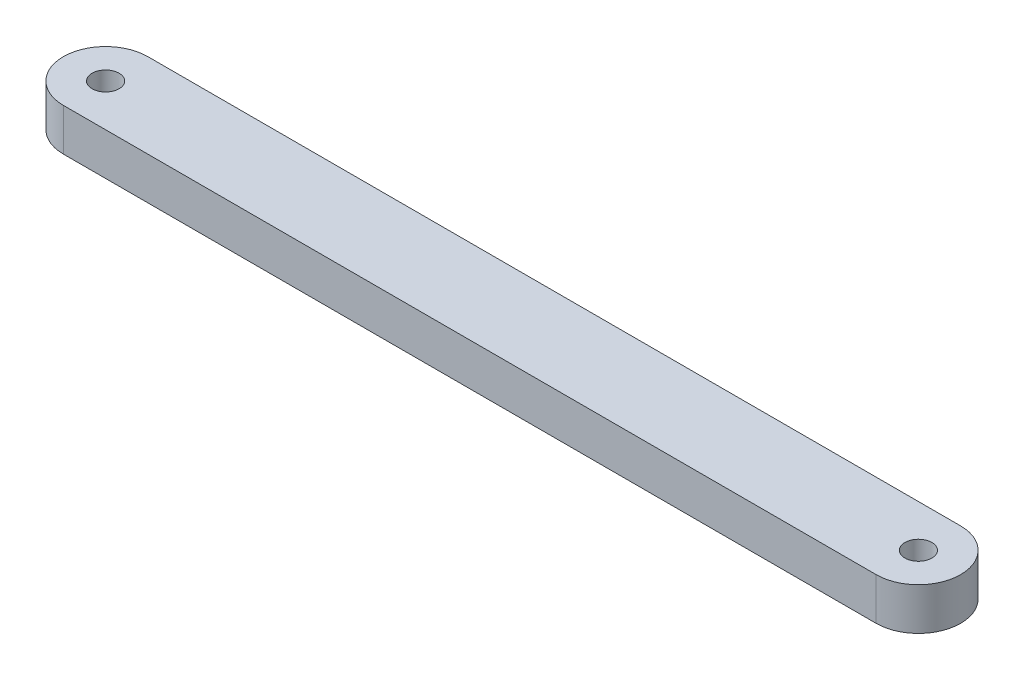
from build123d import *

# Parameters (mm, degrees)
SKETCH_1_R      = 1.6
EXTRUDE_1_DEPTH = 5


with BuildPart() as part:
    # ｽｹｯﾁ1 → ﾎﾞｽ - 押し出し1 (new body)
    with BuildSketch(Plane(origin=(0, 0, 0), x_dir=(1, 0, 0), z_dir=(0, 1, 0))):
        with BuildLine():
            Line((-48.13, 5), (48.13, 5))
            ThreePointArc((48.13, 5), (53.13, 0), (48.13, -5))
            Line((48.13, -5), (-48.13, -5))
            ThreePointArc((-48.13, -5), (-53.13, 0), (-48.13, 5))
        make_face()
        with Locations(Location((-48.13, 0, 0), (0, 0, 270))):
            Circle(SKETCH_1_R, mode=Mode.SUBTRACT)
        with Locations(Location((48.13, 0, 0), (0, 0, 270))):
            Circle(SKETCH_1_R, mode=Mode.SUBTRACT)
    extrude(amount=EXTRUDE_1_DEPTH)


solid = part.part
